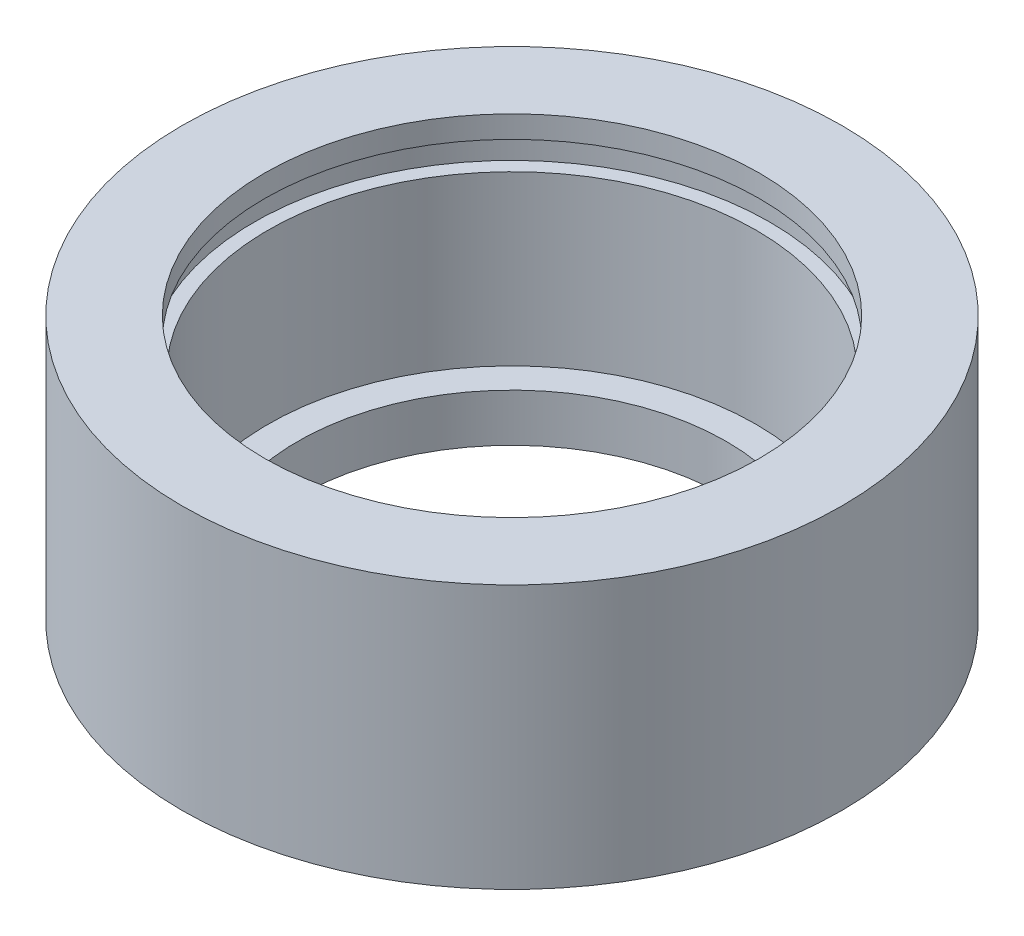
from build123d import *


with BuildPart() as part:
    # Sketch1 → Revolve1 (revolve)
    with BuildSketch(Plane.XY, mode=Mode.PRIVATE) as revolve1_sk:
        Polygon((-12.7, -5.08), (-8.255, -5.08), (-8.255, -3.2385), (-9.398, -3.2385), (-9.398, 3.2385), (-9.9314, 3.2385), (-9.9314, 4.2291), (-9.525, 4.2291), (-9.525, 5.08), (-12.7, 5.08), align=None)
    revolve(revolve1_sk.sketch.rotate(Axis((0, 0, 0), (0, 1, 0)), 270), axis=Axis((0, 0, 0), (0, 1, 0)))


solid = part.part
